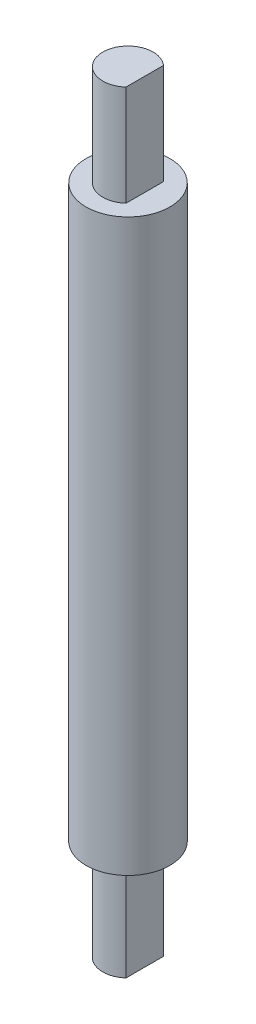
from build123d import *

# Parameters (mm, degrees)
SKETCH_1_R      = 2.5
EXTRUDE_1_DEPTH = 34
EXTRUDE_2_DEPTH = 6
EXTRUDE_START   = 6
EXTRUDE_3_DEPTH = 6


with BuildPart() as part:
    # 草图1 → 凸台-拉伸1 (new body)
    with BuildSketch(Plane(origin=(0, 0, 0), x_dir=(1, 0, 0), z_dir=(0, 1, 0))):
        with Locations(Location((0, 0, 0), (0, 0, 270))):
            Circle(SKETCH_1_R)
    extrude(amount=EXTRUDE_1_DEPTH)

    # 草图2 → 凸台-拉伸2 (add)
    with BuildSketch(Plane(origin=(0, 34, 0), x_dir=(1, 0, 0), z_dir=(0, 1, 0))):
        with BuildLine():
            Line((1, 1.118033989), (1, -1.118033989))
            ThreePointArc((1, -1.118033989), (-1.5, 0), (1, 1.118033989))
        make_face()
    extrude(amount=EXTRUDE_2_DEPTH)

    # 草图3 → 凸台-拉伸3 (add)
    with BuildSketch(Plane.XZ.offset(EXTRUDE_START)):
        with BuildLine():
            Line((1, -1.118033989), (1, 1.118033989))
            ThreePointArc((1, 1.118033989), (-1.5, 0), (1, -1.118033989))
        make_face()
    extrude(amount=-EXTRUDE_3_DEPTH)


solid = part.part
